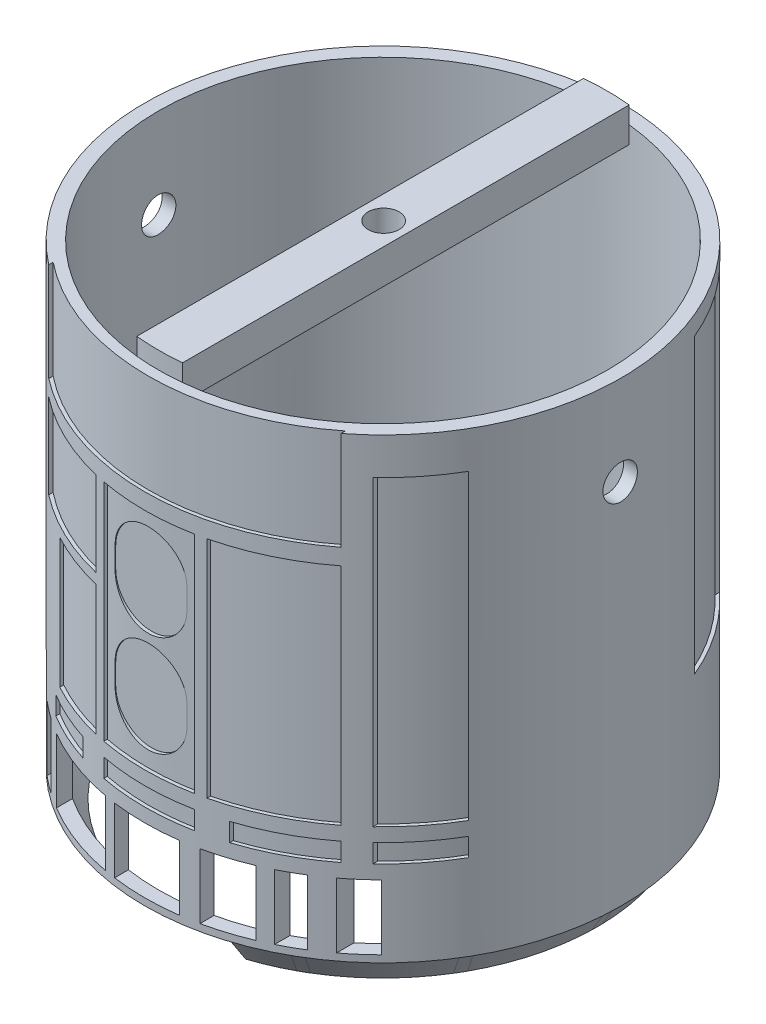
from build123d import *

# Parameters (mm, degrees)
SKETCH2_R                = 87.987395722
SKETCH2_R_2              = 82.907395722
BOSS_EXTRUDE1_DEPTH      = 168.862933
CUT_EXTRUDE6_REACH       = 268.517
CUT_EXTRUDE6_END_RADIUS  = 86.717395722
SKETCH8_W                = 107.95
SKETCH8_H                = 36.403061025
SKETCH8_W_2              = 15.620079368
SKETCH8_H_2              = 111.667948726
SKETCH8_W_3              = 33.443333333
SKETCH8_H_3              = 82.994217369
SKETCH8_H_4              = 31.269296008
SKETCH8_W_4              = 33.443333334
SKETCH8_W_5              = 21.608331091
SKETCH8_H_5              = 47.991274076
SKETCH8_H_6              = 6.815414711
SKETCH8_W_6              = 26.897093015
SKETCH8_W_7              = 18.349196015
SKETCH8_W_8              = 8.912466636
SKETCH8_H_7              = 23.959334779
SKETCH8_W_9              = 7.86394115
SKETCH8_W_10             = 15.727882299
SKETCH8_W_11             = 23.95933478
CUT_EXTRUDE10_DEPTH      = 2.54
CUT_EXTRUDE11_REACH      = 268.517
CUT_EXTRUDE11_END_RADIUS = 86.717395722
SKETCH11_W               = 108.096375172
SKETCH11_H               = 40.979819841
SKETCH11_W_2             = 33.235601919
SKETCH11_H_2             = 62.921770623
SKETCH11_W_3             = 36.13968364
SKETCH11_W_4             = 25.491383996
SKETCH11_H_3             = 9.357596656
SKETCH11_W_5             = 18.392517566
SKETCH11_H_4             = 108.096375172
SKETCH11_W_6             = 21.619275035
CUT_EXTRUDE12_DEPTH      = 357.551894635
CUT_EXTRUDE12_DEPTH_BACK = 357.551894635
SKETCH13_R               = 6.35
BOSS_EXTRUDE2_DEPTH      = 6.35
BOSS_EXTRUDE2_DEPTH_BACK = 6.35
CUT_EXTRUDE14_START      = -12.7
SKETCH16_R               = 5.715
CUT_EXTRUDE14_DEPTH      = 12.7
CUT_EXTRUDE16_REACH      = 268.517
CUT_EXTRUDE16_END_RADIUS = 82.907395722
SKETCH17_W               = 8.912466636
SKETCH17_H               = 23.959334779
SKETCH17_W_2             = 7.86394115
SKETCH17_W_3             = 15.727882299
SKETCH17_W_4             = 23.95933478
SKETCH17_W_5             = 29.133314275
SKETCH17_W_6             = 6.199486919
CUT_EXTRUDE17_REACH      = 268.517
SKETCH18_W               = 49.203543981
SKETCH18_H               = 10.921020299


with BuildPart() as part:
    # Sketch2 → Boss-Extrude1 (new body)
    with BuildSketch(Plane(origin=(0, 71.455025863, 0), x_dir=(-1, 0, 0), z_dir=(0, -1, 0))):
        with Locations(Location((-101.25920442, -93.174917458, 0), (0, 0, 90))):
            Circle(SKETCH2_R)
        with Locations(Location((-101.25920442, -93.174917458, 0), (0, 0, 90))):
            Circle(SKETCH2_R_2, mode=Mode.SUBTRACT)
    extrude(amount=-BOSS_EXTRUDE1_DEPTH)

    # Sketch7 → Revolve-Thin1 (revolve)
    with BuildSketch(Plane(origin=(101.405130669, -9.162101149, 1.503360615), x_dir=(0, 0, -1), z_dir=(1, 0, 0))):
        Polygon((-5.806937432, 80.617127011), (-12.636862845, 69.696106712), (-14.79039845, 71.042911969), (-7.960473037, 81.963932269), align=None)
    revolve(axis=Axis((101.405130669, 51.798054453, 93.340079663), (0, 1, 0)))

    # Cut-Extrude6: up to this cylinder (the profile starts outside it)
    cut_extrude6_end = Plane(origin=(101.25920442, 154.067576, 93.174917458), z_dir=(0, -1, 0)) * Cylinder(CUT_EXTRUDE6_END_RADIUS, 847.566497443, mode=Mode.PRIVATE)
    # Sketch8 → Cut-Extrude6 (cut, up to the surface)
    with BuildSketch(Plane(origin=(101.25920442, 240.317959159, 181.16231318), x_dir=(1, 0, 0), z_dir=(0, 0, 1)), mode=Mode.PRIVATE) as cut_extrude6_sk1:
        with Locations((0, -18.201530512)):
            Rectangle(SKETCH8_W, SKETCH8_H)
    cut_extrude6_tool1 = extrude(cut_extrude6_sk1.sketch, amount=-CUT_EXTRUDE6_REACH, mode=Mode.PRIVATE) - cut_extrude6_end
    add(cut_extrude6_tool1.solids().sort_by_distance((101.259204, 222.116429, 181.162313))[0], mode=Mode.SUBTRACT)
    # Sketch8 → Cut-Extrude6 (cut, up to the surface)
    with BuildSketch(Plane(origin=(101.25920442, 240.317959159, 181.16231318), x_dir=(1, 0, 0), z_dir=(0, 0, 1)), mode=Mode.PRIVATE) as cut_extrude6_sk2:
        with Locations((-68.135039684, -69.510179588)):
            Rectangle(SKETCH8_W_2, SKETCH8_H_2)
    cut_extrude6_tool2 = extrude(cut_extrude6_sk2.sketch, amount=-CUT_EXTRUDE6_REACH, mode=Mode.PRIVATE) - cut_extrude6_end
    add(cut_extrude6_tool2.solids().sort_by_distance((33.124165, 170.80778, 181.162313))[0], mode=Mode.SUBTRACT)
    # Sketch8 → Cut-Extrude6 (cut, up to the surface)
    with BuildSketch(Plane(origin=(101.25920442, 240.317959159, 181.16231318), x_dir=(1, 0, 0), z_dir=(0, 0, 1)), mode=Mode.PRIVATE) as cut_extrude6_sk3:
        with Locations((68.135039684, -69.510179588)):
            Rectangle(SKETCH8_W_2, SKETCH8_H_2)
    cut_extrude6_tool3 = extrude(cut_extrude6_sk3.sketch, amount=-CUT_EXTRUDE6_REACH, mode=Mode.PRIVATE) - cut_extrude6_end
    add(cut_extrude6_tool3.solids().sort_by_distance((169.394244, 170.80778, 181.162313))[0], mode=Mode.SUBTRACT)
    # Sketch8 → Cut-Extrude6 (cut, up to the surface)
    with BuildSketch(Plane(origin=(101.25920442, 240.317959159, 181.16231318), x_dir=(1, 0, 0), z_dir=(0, 0, 1)), mode=Mode.PRIVATE) as cut_extrude6_sk4:
        with Locations((37.253333334, -83.847045267)):
            Rectangle(SKETCH8_W_3, SKETCH8_H_3)
    cut_extrude6_tool4 = extrude(cut_extrude6_sk4.sketch, amount=-CUT_EXTRUDE6_REACH, mode=Mode.PRIVATE) - cut_extrude6_end
    add(cut_extrude6_tool4.solids().sort_by_distance((138.512538, 156.470914, 181.162313))[0], mode=Mode.SUBTRACT)
    # Sketch8 → Cut-Extrude6 (cut, up to the surface)
    with BuildSketch(Plane(origin=(101.25920442, 240.317959159, 181.16231318), x_dir=(1, 0, 0), z_dir=(0, 0, 1)), mode=Mode.PRIVATE) as cut_extrude6_sk5:
        with Locations((-37.253333334, -57.984584586)):
            Rectangle(SKETCH8_W_3, SKETCH8_H_4)
    cut_extrude6_tool5 = extrude(cut_extrude6_sk5.sketch, amount=-CUT_EXTRUDE6_REACH, mode=Mode.PRIVATE) - cut_extrude6_end
    add(cut_extrude6_tool5.solids().sort_by_distance((64.005871, 182.333375, 181.162313))[0], mode=Mode.SUBTRACT)
    # Sketch8 → Cut-Extrude6 (cut, up to the surface)
    with BuildSketch(Plane(origin=(101.25920442, 240.317959159, 181.16231318), x_dir=(1, 0, 0), z_dir=(0, 0, 1)), mode=Mode.PRIVATE) as cut_extrude6_sk6:
        with Locations((0, -83.847045267)):
            Rectangle(SKETCH8_W_4, SKETCH8_H_3)
    cut_extrude6_tool6 = extrude(cut_extrude6_sk6.sketch, amount=-CUT_EXTRUDE6_REACH, mode=Mode.PRIVATE) - cut_extrude6_end
    add(cut_extrude6_tool6.solids().sort_by_distance((101.259204, 156.470914, 181.162313))[0], mode=Mode.SUBTRACT)
    # Sketch8 → Cut-Extrude6 (cut, up to the surface)
    with BuildSketch(Plane(origin=(101.25920442, 240.317959159, 181.16231318), x_dir=(1, 0, 0), z_dir=(0, 0, 1)), mode=Mode.PRIVATE) as cut_extrude6_sk7:
        with Locations((-31.335832213, -101.348516913)):
            Rectangle(SKETCH8_W_5, SKETCH8_H_5)
    cut_extrude6_tool7 = extrude(cut_extrude6_sk7.sketch, amount=-CUT_EXTRUDE6_REACH, mode=Mode.PRIVATE) - cut_extrude6_end
    add(cut_extrude6_tool7.solids().sort_by_distance((69.923372, 138.969442, 181.162313))[0], mode=Mode.SUBTRACT)
    # Sketch8 → Cut-Extrude6 (cut, up to the surface)
    with BuildSketch(Plane(origin=(101.25920442, 240.317959159, 181.16231318), x_dir=(1, 0, 0), z_dir=(0, 0, 1)), mode=Mode.PRIVATE) as cut_extrude6_sk8:
        with Locations((68.135039684, -133.831861307)):
            Rectangle(SKETCH8_W_2, SKETCH8_H_6)
    cut_extrude6_tool8 = extrude(cut_extrude6_sk8.sketch, amount=-CUT_EXTRUDE6_REACH, mode=Mode.PRIVATE) - cut_extrude6_end
    add(cut_extrude6_tool8.solids().sort_by_distance((169.394244, 106.486098, 181.162313))[0], mode=Mode.SUBTRACT)
    # Sketch8 → Cut-Extrude6 (cut, up to the surface)
    with BuildSketch(Plane(origin=(101.25920442, 240.317959159, 181.16231318), x_dir=(1, 0, 0), z_dir=(0, 0, 1)), mode=Mode.PRIVATE) as cut_extrude6_sk9:
        with Locations((40.526453493, -133.831861307)):
            Rectangle(SKETCH8_W_6, SKETCH8_H_6)
    cut_extrude6_tool9 = extrude(cut_extrude6_sk9.sketch, amount=-CUT_EXTRUDE6_REACH, mode=Mode.PRIVATE) - cut_extrude6_end
    add(cut_extrude6_tool9.solids().sort_by_distance((141.785658, 106.486098, 181.162313))[0], mode=Mode.SUBTRACT)
    # Sketch8 → Cut-Extrude6 (cut, up to the surface)
    with BuildSketch(Plane(origin=(101.25920442, 240.317959159, 181.16231318), x_dir=(1, 0, 0), z_dir=(0, 0, 1)), mode=Mode.PRIVATE) as cut_extrude6_sk10:
        with Locations((0, -133.831861307)):
            Rectangle(SKETCH8_W_4, SKETCH8_H_6)
    cut_extrude6_tool10 = extrude(cut_extrude6_sk10.sketch, amount=-CUT_EXTRUDE6_REACH, mode=Mode.PRIVATE) - cut_extrude6_end
    add(cut_extrude6_tool10.solids().sort_by_distance((101.259204, 106.486098, 181.162313))[0], mode=Mode.SUBTRACT)
    # Sketch8 → Cut-Extrude6 (cut, up to the surface)
    with BuildSketch(Plane(origin=(101.25920442, 240.317959159, 181.16231318), x_dir=(1, 0, 0), z_dir=(0, 0, 1)), mode=Mode.PRIVATE) as cut_extrude6_sk11:
        with Locations((-36.357884953, -133.831861307)):
            Rectangle(SKETCH8_W_7, SKETCH8_H_6)
    cut_extrude6_tool11 = extrude(cut_extrude6_sk11.sketch, amount=-CUT_EXTRUDE6_REACH, mode=Mode.PRIVATE) - cut_extrude6_end
    add(cut_extrude6_tool11.solids().sort_by_distance((64.901319, 106.486098, 181.162313))[0], mode=Mode.SUBTRACT)
    # Sketch8 → Cut-Extrude6 (cut, up to the surface)
    with BuildSketch(Plane(origin=(101.25920442, 240.317959159, 181.16231318), x_dir=(1, 0, 0), z_dir=(0, 0, 1)), mode=Mode.PRIVATE) as cut_extrude6_sk12:
        with Locations((57.485146096, -154.299236052)):
            Rectangle(SKETCH8_W_8, SKETCH8_H_7)
    cut_extrude6_tool12 = extrude(cut_extrude6_sk12.sketch, amount=-CUT_EXTRUDE6_REACH, mode=Mode.PRIVATE) - cut_extrude6_end
    add(cut_extrude6_tool12.solids().sort_by_distance((158.744351, 86.018723, 181.162313))[0], mode=Mode.SUBTRACT)
    # Sketch8 → Cut-Extrude6 (cut, up to the surface)
    with BuildSketch(Plane(origin=(101.25920442, 240.317959159, 181.16231318), x_dir=(1, 0, 0), z_dir=(0, 0, 1)), mode=Mode.PRIVATE) as cut_extrude6_sk13:
        with Locations((42.805789284, -154.299236052)):
            Rectangle(SKETCH8_W_9, SKETCH8_H_7)
    cut_extrude6_tool13 = extrude(cut_extrude6_sk13.sketch, amount=-CUT_EXTRUDE6_REACH, mode=Mode.PRIVATE) - cut_extrude6_end
    add(cut_extrude6_tool13.solids().sort_by_distance((144.064994, 86.018723, 181.162313))[0], mode=Mode.SUBTRACT)
    # Sketch8 → Cut-Extrude6 (cut, up to the surface)
    with BuildSketch(Plane(origin=(101.25920442, 240.317959159, 181.16231318), x_dir=(1, 0, 0), z_dir=(0, 0, 1)), mode=Mode.PRIVATE) as cut_extrude6_sk14:
        with Locations((26.291512871, -154.299236052)):
            Rectangle(SKETCH8_W_10, SKETCH8_H_7)
    cut_extrude6_tool14 = extrude(cut_extrude6_sk14.sketch, amount=-CUT_EXTRUDE6_REACH, mode=Mode.PRIVATE) - cut_extrude6_end
    add(cut_extrude6_tool14.solids().sort_by_distance((127.550717, 86.018723, 181.162313))[0], mode=Mode.SUBTRACT)
    # Sketch8 → Cut-Extrude6 (cut, up to the surface)
    with BuildSketch(Plane(origin=(101.25920442, 240.317959159, 181.16231318), x_dir=(1, 0, 0), z_dir=(0, 0, 1)), mode=Mode.PRIVATE) as cut_extrude6_sk15:
        with Locations((0, -154.299236052)):
            Rectangle(SKETCH8_W_11, SKETCH8_H_7)
    cut_extrude6_tool15 = extrude(cut_extrude6_sk15.sketch, amount=-CUT_EXTRUDE6_REACH, mode=Mode.PRIVATE) - cut_extrude6_end
    add(cut_extrude6_tool15.solids().sort_by_distance((101.259204, 86.018723, 181.162313))[0], mode=Mode.SUBTRACT)

    # Sketch10 → Cut-Extrude10 (cut)
    with BuildSketch(Plane(origin=(101.25920442, 240.317959159, 181.16231318), x_dir=(1, 0, 0), z_dir=(0, 0, 1))):
        with BuildLine():
            Line((-13.264804804, -61.399936582), (-13.264804804, -69.019936582))
            ThreePointArc((-13.264804804, -69.019936582), (0, -82.284741385), (13.264804804, -69.019936582))
            Line((13.264804804, -69.019936582), (13.264804804, -61.399936582))
            ThreePointArc((13.264804804, -61.399936582), (0, -48.135131778), (-13.264804804, -61.399936582))
        make_face()
        with BuildLine():
            Line((-13.264804804, -98.674153951), (-13.264804804, -106.294153951))
            ThreePointArc((-13.264804804, -106.294153951), (0, -119.558958755), (13.264804804, -106.294153951))
            Line((13.264804804, -106.294153951), (13.264804804, -98.674153951))
            ThreePointArc((13.264804804, -98.674153951), (0, -85.409349148), (-13.264804804, -98.674153951))
        make_face()
    extrude(amount=-CUT_EXTRUDE10_DEPTH, mode=Mode.SUBTRACT)

    # Cut-Extrude11: up to this cylinder (the profile starts outside it)
    cut_extrude11_end = Plane(origin=(101.25920442, 163.204329, 93.174917458), z_dir=(0, -1, 0)) * Cylinder(CUT_EXTRUDE11_END_RADIUS, 810.852921443, mode=Mode.PRIVATE)
    # Sketch11 → Cut-Extrude11 (cut, up to the surface)
    with BuildSketch(Plane(origin=(101.25920442, 240.317959159, 5.187521736), x_dir=(-1, 0, 0), z_dir=(0, 0, -1)), mode=Mode.PRIVATE) as cut_extrude11_sk1:
        with Locations((1.186407484, -27.421565499)):
            Rectangle(SKETCH11_W, SKETCH11_H)
    cut_extrude11_tool1 = extrude(cut_extrude11_sk1.sketch, amount=-CUT_EXTRUDE11_REACH, mode=Mode.PRIVATE) - cut_extrude11_end
    add(cut_extrude11_tool1.solids().sort_by_distance((100.072797, 212.896394, 5.187522))[0], mode=Mode.SUBTRACT)
    # Sketch11 → Cut-Extrude11 (cut, up to the surface)
    with BuildSketch(Plane(origin=(101.25920442, 240.317959159, 5.187521736), x_dir=(-1, 0, 0), z_dir=(0, 0, -1)), mode=Mode.PRIVATE) as cut_extrude11_sk2:
        with Locations((-36.243979143, -83.567145439)):
            Rectangle(SKETCH11_W_2, SKETCH11_H_2)
    cut_extrude11_tool2 = extrude(cut_extrude11_sk2.sketch, amount=-CUT_EXTRUDE11_REACH, mode=Mode.PRIVATE) - cut_extrude11_end
    add(cut_extrude11_tool2.solids().sort_by_distance((137.503184, 156.750814, 5.187522))[0], mode=Mode.SUBTRACT)
    # Sketch11 → Cut-Extrude11 (cut, up to the surface)
    with BuildSketch(Plane(origin=(101.25920442, 240.317959159, 5.187521736), x_dir=(-1, 0, 0), z_dir=(0, 0, -1)), mode=Mode.PRIVATE) as cut_extrude11_sk3:
        with Locations((4.897178572, -83.567145439)):
            Rectangle(SKETCH11_W_3, SKETCH11_H_2)
    cut_extrude11_tool3 = extrude(cut_extrude11_sk3.sketch, amount=-CUT_EXTRUDE11_REACH, mode=Mode.PRIVATE) - cut_extrude11_end
    add(cut_extrude11_tool3.solids().sort_by_distance((96.362026, 156.750814, 5.187522))[0], mode=Mode.SUBTRACT)
    # Sketch11 → Cut-Extrude11 (cut, up to the surface)
    with BuildSketch(Plane(origin=(101.25920442, 240.317959159, 5.187521736), x_dir=(-1, 0, 0), z_dir=(0, 0, -1)), mode=Mode.PRIVATE) as cut_extrude11_sk4:
        with Locations((42.488903072, -83.567145439)):
            Rectangle(SKETCH11_W_4, SKETCH11_H_2)
    cut_extrude11_tool4 = extrude(cut_extrude11_sk4.sketch, amount=-CUT_EXTRUDE11_REACH, mode=Mode.PRIVATE) - cut_extrude11_end
    add(cut_extrude11_tool4.solids().sort_by_distance((58.770301, 156.750814, 5.187522))[0], mode=Mode.SUBTRACT)
    # Sketch11 → Cut-Extrude11 (cut, up to the surface)
    with BuildSketch(Plane(origin=(101.25920442, 240.317959159, 5.187521736), x_dir=(-1, 0, 0), z_dir=(0, 0, -1)), mode=Mode.PRIVATE) as cut_extrude11_sk5:
        with Locations((-36.243979143, -126.805695507)):
            Rectangle(SKETCH11_W_2, SKETCH11_H_3)
    cut_extrude11_tool5 = extrude(cut_extrude11_sk5.sketch, amount=-CUT_EXTRUDE11_REACH, mode=Mode.PRIVATE) - cut_extrude11_end
    add(cut_extrude11_tool5.solids().sort_by_distance((137.503184, 113.512264, 5.187522))[0], mode=Mode.SUBTRACT)
    # Sketch11 → Cut-Extrude11 (cut, up to the surface)
    with BuildSketch(Plane(origin=(101.25920442, 240.317959159, 5.187521736), x_dir=(-1, 0, 0), z_dir=(0, 0, -1)), mode=Mode.PRIVATE) as cut_extrude11_sk6:
        with Locations((4.897178572, -126.805695507)):
            Rectangle(SKETCH11_W_3, SKETCH11_H_3)
    cut_extrude11_tool6 = extrude(cut_extrude11_sk6.sketch, amount=-CUT_EXTRUDE11_REACH, mode=Mode.PRIVATE) - cut_extrude11_end
    add(cut_extrude11_tool6.solids().sort_by_distance((96.362026, 113.512264, 5.187522))[0], mode=Mode.SUBTRACT)
    # Sketch11 → Cut-Extrude11 (cut, up to the surface)
    with BuildSketch(Plane(origin=(101.25920442, 240.317959159, 5.187521736), x_dir=(-1, 0, 0), z_dir=(0, 0, -1)), mode=Mode.PRIVATE) as cut_extrude11_sk7:
        with Locations((42.488903072, -126.805695507)):
            Rectangle(SKETCH11_W_4, SKETCH11_H_3)
    cut_extrude11_tool7 = extrude(cut_extrude11_sk7.sketch, amount=-CUT_EXTRUDE11_REACH, mode=Mode.PRIVATE) - cut_extrude11_end
    add(cut_extrude11_tool7.solids().sort_by_distance((58.770301, 113.512264, 5.187522))[0], mode=Mode.SUBTRACT)
    # Sketch11 → Cut-Extrude11 (cut, up to the surface)
    with BuildSketch(Plane(origin=(101.25920442, 240.317959159, 5.187521736), x_dir=(-1, 0, 0), z_dir=(0, 0, -1)), mode=Mode.PRIVATE) as cut_extrude11_sk8:
        with Locations((72.497747523, -60.979843164)):
            Rectangle(SKETCH11_W_5, SKETCH11_H_4)
    cut_extrude11_tool8 = extrude(cut_extrude11_sk8.sketch, amount=-CUT_EXTRUDE11_REACH, mode=Mode.PRIVATE) - cut_extrude11_end
    add(cut_extrude11_tool8.solids().sort_by_distance((28.761457, 179.338116, 5.187522))[0], mode=Mode.SUBTRACT)
    # Sketch11 → Cut-Extrude11 (cut, up to the surface)
    with BuildSketch(Plane(origin=(101.25920442, 240.317959159, 5.187521736), x_dir=(-1, 0, 0), z_dir=(0, 0, -1)), mode=Mode.PRIVATE) as cut_extrude11_sk9:
        with Locations((-70.447608301, -60.979843164)):
            Rectangle(SKETCH11_W_6, SKETCH11_H_4)
    cut_extrude11_tool9 = extrude(cut_extrude11_sk9.sketch, amount=-CUT_EXTRUDE11_REACH, mode=Mode.PRIVATE) - cut_extrude11_end
    add(cut_extrude11_tool9.solids().sort_by_distance((171.706813, 179.338116, 5.187522))[0], mode=Mode.SUBTRACT)
    # Sketch11 → Cut-Extrude11 (cut, up to the surface)
    with BuildSketch(Plane(origin=(101.25920442, 240.317959159, 5.187521736), x_dir=(-1, 0, 0), z_dir=(0, 0, -1)), mode=Mode.PRIVATE) as cut_extrude11_sk10:
        with Locations((72.497747523, -126.805695507)):
            Rectangle(SKETCH11_W_5, SKETCH11_H_3)
    cut_extrude11_tool10 = extrude(cut_extrude11_sk10.sketch, amount=-CUT_EXTRUDE11_REACH, mode=Mode.PRIVATE) - cut_extrude11_end
    add(cut_extrude11_tool10.solids().sort_by_distance((28.761457, 113.512264, 5.187522))[0], mode=Mode.SUBTRACT)

    # Sketch13 → Cut-Extrude12 (cut, two sides: drawn at the far end of the back side and taken through both)
    with BuildSketch(Plane(origin=(204.47, 0, 0), x_dir=(0, 0, -1), z_dir=(1, 0, 0)).offset(-CUT_EXTRUDE12_DEPTH_BACK)):
        with Locations(Location((-93.340079663, 207.16205708, 0), (0, 0, 90))):
            Circle(SKETCH13_R)
    extrude(amount=CUT_EXTRUDE12_DEPTH + CUT_EXTRUDE12_DEPTH_BACK, mode=Mode.SUBTRACT)

    # Sketch15 → Boss-Extrude2 (add, two sides: drawn at the far end of the back side and taken through both)
    with BuildSketch(Plane(origin=(0, 240.317959159, 0), x_dir=(1, 0, 0), z_dir=(0, 1, 0)).offset(-BOSS_EXTRUDE2_DEPTH_BACK)):
        with BuildLine():
            Line((109.720559869, -10.700426072), (109.720559869, -175.649408844))
            ThreePointArc((109.720559869, -175.649408844), (101.25920442, -176.08231318), (92.797848972, -175.649408844))
            Line((92.797848972, -175.649408844), (92.797848972, -10.700426072))
            ThreePointArc((92.797848972, -10.700426072), (101.25920442, -10.267521736), (109.720559869, -10.700426072))
        make_face()
    extrude(amount=BOSS_EXTRUDE2_DEPTH + BOSS_EXTRUDE2_DEPTH_BACK)

    # Sketch16 → Cut-Extrude14 (cut)
    with BuildSketch(Plane(origin=(0, 246.667959159, 0), x_dir=(1, 0, 0), z_dir=(0, 1, 0)).offset(CUT_EXTRUDE14_START)):
        with Locations(Location((101.405130669, -93.090079663, 0), (0, 0, 270))):
            Circle(SKETCH16_R)
    extrude(amount=CUT_EXTRUDE14_DEPTH, mode=Mode.SUBTRACT)

    # Cut-Extrude16: up to this cylinder (the profile starts outside it)
    cut_extrude16_end = Plane(origin=(101.25920442, 86.018723, 93.174917458), z_dir=(0, -1, 0)) * Cylinder(CUT_EXTRUDE16_END_RADIUS, 703.848791443, mode=Mode.PRIVATE)
    # Sketch17 → Cut-Extrude16 (cut, up to the surface)
    with BuildSketch(Plane(origin=(101.25920442, 240.317959159, 181.16231318), x_dir=(1, 0, 0), z_dir=(0, 0, 1)), mode=Mode.PRIVATE) as cut_extrude16_sk1:
        with Locations((57.485146096, -154.299236052)):
            Rectangle(SKETCH17_W, SKETCH17_H)
    cut_extrude16_tool1 = extrude(cut_extrude16_sk1.sketch, amount=-CUT_EXTRUDE16_REACH, mode=Mode.PRIVATE) - cut_extrude16_end
    add(cut_extrude16_tool1.solids().sort_by_distance((158.744351, 86.018723, 181.162313))[0], mode=Mode.SUBTRACT)
    # Sketch17 → Cut-Extrude16 (cut, up to the surface)
    with BuildSketch(Plane(origin=(101.25920442, 240.317959159, 181.16231318), x_dir=(1, 0, 0), z_dir=(0, 0, 1)), mode=Mode.PRIVATE) as cut_extrude16_sk2:
        with Locations((42.805789284, -154.299236052)):
            Rectangle(SKETCH17_W_2, SKETCH17_H)
    cut_extrude16_tool2 = extrude(cut_extrude16_sk2.sketch, amount=-CUT_EXTRUDE16_REACH, mode=Mode.PRIVATE) - cut_extrude16_end
    add(cut_extrude16_tool2.solids().sort_by_distance((144.064994, 86.018723, 181.162313))[0], mode=Mode.SUBTRACT)
    # Sketch17 → Cut-Extrude16 (cut, up to the surface)
    with BuildSketch(Plane(origin=(101.25920442, 240.317959159, 181.16231318), x_dir=(1, 0, 0), z_dir=(0, 0, 1)), mode=Mode.PRIVATE) as cut_extrude16_sk3:
        with Locations((26.291512871, -154.299236052)):
            Rectangle(SKETCH17_W_3, SKETCH17_H)
    cut_extrude16_tool3 = extrude(cut_extrude16_sk3.sketch, amount=-CUT_EXTRUDE16_REACH, mode=Mode.PRIVATE) - cut_extrude16_end
    add(cut_extrude16_tool3.solids().sort_by_distance((127.550717, 86.018723, 181.162313))[0], mode=Mode.SUBTRACT)
    # Sketch17 → Cut-Extrude16 (cut, up to the surface)
    with BuildSketch(Plane(origin=(101.25920442, 240.317959159, 181.16231318), x_dir=(1, 0, 0), z_dir=(0, 0, 1)), mode=Mode.PRIVATE) as cut_extrude16_sk4:
        with Locations((0, -154.299236052)):
            Rectangle(SKETCH17_W_4, SKETCH17_H)
    cut_extrude16_tool4 = extrude(cut_extrude16_sk4.sketch, amount=-CUT_EXTRUDE16_REACH, mode=Mode.PRIVATE) - cut_extrude16_end
    add(cut_extrude16_tool4.solids().sort_by_distance((101.259204, 86.018723, 181.162313))[0], mode=Mode.SUBTRACT)
    # Sketch17 → Cut-Extrude16 (cut, up to the surface)
    with BuildSketch(Plane(origin=(101.25920442, 240.317959159, 181.16231318), x_dir=(1, 0, 0), z_dir=(0, 0, 1)), mode=Mode.PRIVATE) as cut_extrude16_sk5:
        with Locations((-30.524054993, -154.299236052)):
            Rectangle(SKETCH17_W_5, SKETCH17_H)
    cut_extrude16_tool5 = extrude(cut_extrude16_sk5.sketch, amount=-CUT_EXTRUDE16_REACH, mode=Mode.PRIVATE) - cut_extrude16_end
    add(cut_extrude16_tool5.solids().sort_by_distance((70.735149, 86.018723, 181.162313))[0], mode=Mode.SUBTRACT)
    # Sketch17 → Cut-Extrude16 (cut, up to the surface)
    with BuildSketch(Plane(origin=(101.25920442, 240.317959159, 181.16231318), x_dir=(1, 0, 0), z_dir=(0, 0, 1)), mode=Mode.PRIVATE) as cut_extrude16_sk6:
        with Locations((-54.068039898, -154.299236052)):
            Rectangle(SKETCH17_W_6, SKETCH17_H)
    cut_extrude16_tool6 = extrude(cut_extrude16_sk6.sketch, amount=-CUT_EXTRUDE16_REACH, mode=Mode.PRIVATE) - cut_extrude16_end
    add(cut_extrude16_tool6.solids().sort_by_distance((47.191165, 86.018723, 181.162313))[0], mode=Mode.SUBTRACT)

    # Cut-Extrude17: up to this cone (the profile starts outside it)
    cut_extrude17_end = Plane(origin=(101.405130669, 65.994516, 93.340079663), z_dir=(0, 1, 0)).offset(-127.310427478) * Cone(1e-06, 297.653381067, 475.946428905, align=(Align.CENTER, Align.CENTER, Align.MIN), mode=Mode.PRIVATE)
    # Sketch18 → Cut-Extrude17 (cut, up to the surface)
    with BuildSketch(Plane(origin=(101.25920442, 240.317959159, 181.16231318), x_dir=(1, 0, 0), z_dir=(0, 0, 1)), mode=Mode.PRIVATE) as cut_extrude17_sk1:
        with Locations((0.145926249, -174.323443446)):
            Rectangle(SKETCH18_W, SKETCH18_H)
    cut_extrude17_tool1 = extrude(cut_extrude17_sk1.sketch, amount=-CUT_EXTRUDE17_REACH, mode=Mode.PRIVATE) - cut_extrude17_end
    add(cut_extrude17_tool1.solids().sort_by_distance((101.405131, 65.994516, 181.162313))[0], mode=Mode.SUBTRACT)


solid = part.part
